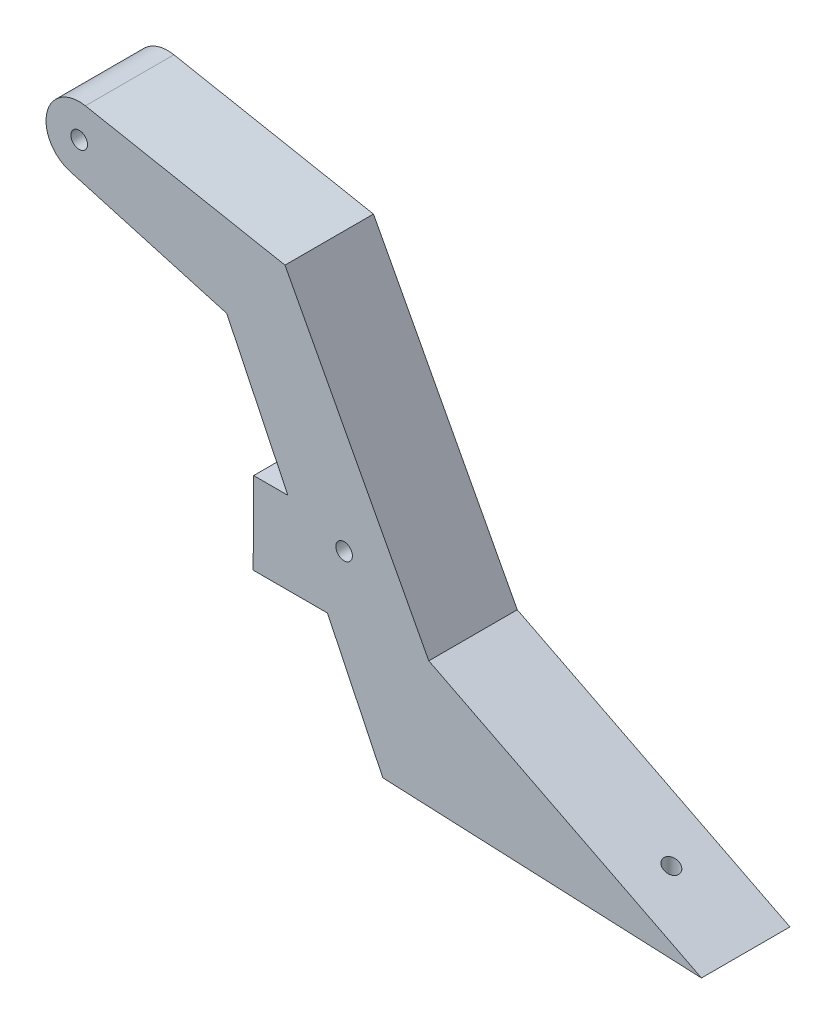
from build123d import *

# Parameters (mm, degrees)
SKETCH_1_R          = 1.5
EXTRUDE_1_DEPTH     = 16
SKETCH_2_R          = 1.35
CUT_EXTRUDE_1_DEPTH = 10
CUT_EXTRUDE_2_DEPTH = 33
EXTRUDE_2_DEPTH     = 16
SKETCH_5_R          = 1.5
CUT_EXTRUDE_3_DEPTH = 24
SKETCH_7_R          = 1.8
CUT_EXTRUDE_5_DEPTH = 10


with BuildPart() as part:
    # 草图1 → 凸台-拉伸1 (new body)
    with BuildSketch(Plane.XY):
        with BuildLine():
            Line((1.126380295, 5.893323971), (37.220974686, -1.005370225))
            Line((37.220974686, -1.005370225), (63.227984205, -49.979924472))
            Line((63.227984205, -49.979924472), (112.538061605, -75))
            Line((112.538061605, -75), (53.330616959, -72.391905084))
            Line((53.330616959, -72.391905084), (49.915441771, -64.88738307))
            Line((49.915441771, -64.88738307), (26.682733599, -13.835720919))
            Line((26.682733599, -13.835720919), (-1.643050648, -5.77064854))
            ThreePointArc((-1.643050648, -5.77064854), (-5.837705093, 1.386073321), (1.126380295, 5.893323971))
        make_face()
        Circle(SKETCH_1_R, mode=Mode.SUBTRACT)
    extrude(amount=EXTRUDE_1_DEPTH)

    # 草图2 → 切除-拉伸1 (cut)
    with BuildSketch(Plane(origin=(-3.079413203, -69.907036606, 0), x_dir=(0.9990312032291818, -0.044007442262116094, 0), z_dir=(-0.044007442262116094, -0.9990312032291818, 0))):
        with Locations((66, 8)):
            Circle(SKETCH_2_R)
        with Locations((102, 8)):
            Circle(SKETCH_2_R)
        with Locations((84, 8)):
            Circle(SKETCH_2_R)
    extrude(amount=-CUT_EXTRUDE_1_DEPTH, mode=Mode.SUBTRACT)

    # 草图3 → 切除-拉伸2 (cut)
    with BuildSketch(Plane.XY.offset(16)):
        Polygon((26.682733599, -13.835720919), (54.911117554, -72.461526322), (53.330616959, -72.391905084), align=None)
    extrude(amount=-CUT_EXTRUDE_2_DEPTH, mode=Mode.SUBTRACT)

    # 草图4 → 凸台-拉伸2 (add)
    with BuildSketch(Plane.XY.offset(16)):
        Polygon((44.895473102, -51.660646486), (37.739057149, -36.797923572), (31.552939366, -36.797923572), (31.460941411, -51.660646486), align=None)
    extrude(amount=-EXTRUDE_2_DEPTH)

    # 草图5 → 切除-拉伸3 (cut)
    with BuildSketch(Plane.XY.offset(16)):
        with Locations((47.911117554, -40.461526322)):
            Circle(SKETCH_5_R)
    extrude(amount=-CUT_EXTRUDE_3_DEPTH, mode=Mode.SUBTRACT)

    # 草图7 → 切除-拉伸5 (cut)
    with BuildSketch(Plane(origin=(31.779495214, -0.196710159, 0), x_dir=(0, 0, 1), z_dir=(-0.9999808434581536, 0.006189726708003564, 0))):
        with Locations(Location((8, -44.015961614, 0), (0, 0, 270))):
            Circle(SKETCH_7_R)
    extrude(amount=-CUT_EXTRUDE_5_DEPTH, mode=Mode.SUBTRACT)


solid = part.part
